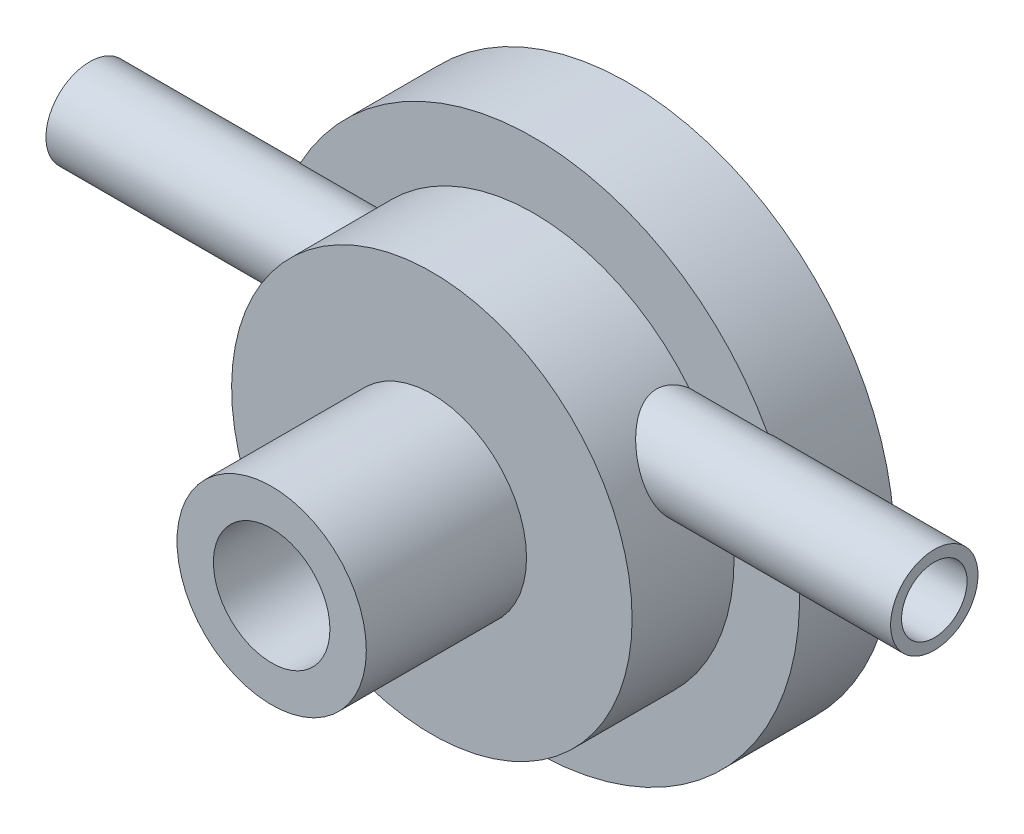
from build123d import *

# Parameters (mm, degrees)
SKETCH1_R                = 36.5
BOSS_EXTRUDE1_DEPTH      = 13
SKETCH2_R                = 27.5
BOSS_EXTRUDE2_DEPTH      = 14
SKETCH3_R                = 13
BOSS_EXTRUDE3_DEPTH      = 22
SKETCH4_R                = 8
CUT_EXTRUDE1_DEPTH       = 72.172326083
BOSS_EXTRUDE4_DEPTH      = 22
BOSS_EXTRUDE4_DEPTH_BACK = 94
SKETCH6_R                = 6
SKETCH8_RX               = 22.241182767
SKETCH8_RY               = 20.063201952
CUT_EXTRUDE2_DEPTH       = 13
SKETCH10_R               = 4.5
CUT_EXTRUDE3_DEPTH       = 132.107780243


with BuildPart() as part:
    # Sketch1 → Boss-Extrude1 (new body)
    with BuildSketch(Plane.XY):
        with Locations(Location((0, 0, 0), (0, 0, 180))):
            Circle(SKETCH1_R)
    extrude(amount=BOSS_EXTRUDE1_DEPTH)

    # Sketch2 → Boss-Extrude2 (add)
    with BuildSketch(Plane.XY.offset(13)):
        Circle(SKETCH2_R)
    extrude(amount=BOSS_EXTRUDE2_DEPTH)

    # Sketch3 → Boss-Extrude3 (add)
    with BuildSketch(Plane.XY.offset(27)):
        Circle(SKETCH3_R)
    extrude(amount=BOSS_EXTRUDE3_DEPTH)

    # Sketch4 → Cut-Extrude1 (cut, through all)
    with BuildSketch(Plane.XY.offset(49)):
        Circle(SKETCH4_R)
    extrude(amount=-CUT_EXTRUDE1_DEPTH, mode=Mode.SUBTRACT)

    # Sketch6 → Boss-Extrude4 (add, two sides: drawn at the far end of the back side and taken through both)
    with BuildSketch(Plane(origin=(36.5, 0, 0), x_dir=(0, 0, -1), z_dir=(1, 0, 0)).offset(-BOSS_EXTRUDE4_DEPTH_BACK)):
        with Locations((-16.5, 12.5)):
            Circle(SKETCH6_R)
    extrude(amount=BOSS_EXTRUDE4_DEPTH + BOSS_EXTRUDE4_DEPTH_BACK)

    # Sketch8 → Cut-Extrude2 (cut)
    with BuildSketch(Plane(origin=(0, 0, 0), x_dir=(-1, 0, 0), z_dir=(0, 0, -1))):
        with Locations((0, 0)):
            Ellipse(SKETCH8_RX, SKETCH8_RY)
    extrude(amount=-CUT_EXTRUDE2_DEPTH, mode=Mode.SUBTRACT)

    # Sketch10 → Cut-Extrude3 (cut, through all)
    with BuildSketch(Plane(origin=(58.5, 0, 0), x_dir=(0, 0, -1), z_dir=(1, 0, 0))):
        with Locations((-16.5, 12.5)):
            Circle(SKETCH10_R)
    extrude(amount=-CUT_EXTRUDE3_DEPTH, mode=Mode.SUBTRACT)


solid = part.part
